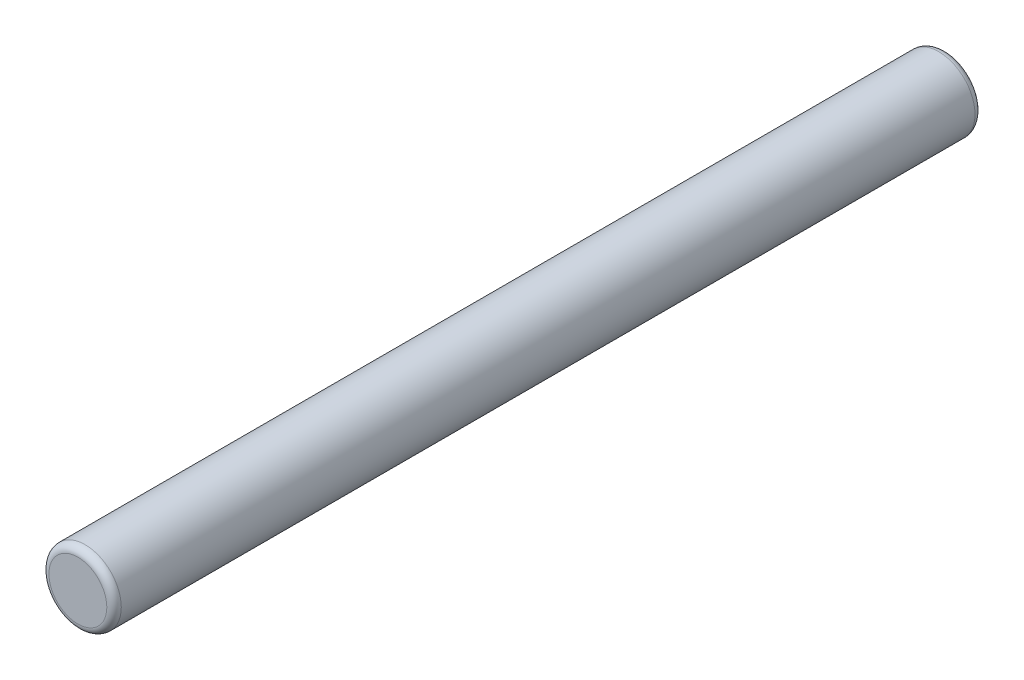
from build123d import *

# Parameters (mm, degrees)
SKETCH1_R           = 2.5
BOSS_EXTRUDE1_DEPTH = 60
FILLET1_R           = 0.5


with BuildPart() as part:
    # Sketch1 → Boss-Extrude1 (new body)
    with BuildSketch(Plane.XY):
        Circle(SKETCH1_R)
    extrude(amount=BOSS_EXTRUDE1_DEPTH)

    # Fillet1
    fillet1_edges = [part.edges().sort_by_distance(p)[0] for p in [
        (-2.5, 0, 0),
        (-2.5, 0, 60),
    ]]
    fillet(fillet1_edges, radius=FILLET1_R)


solid = part.part
